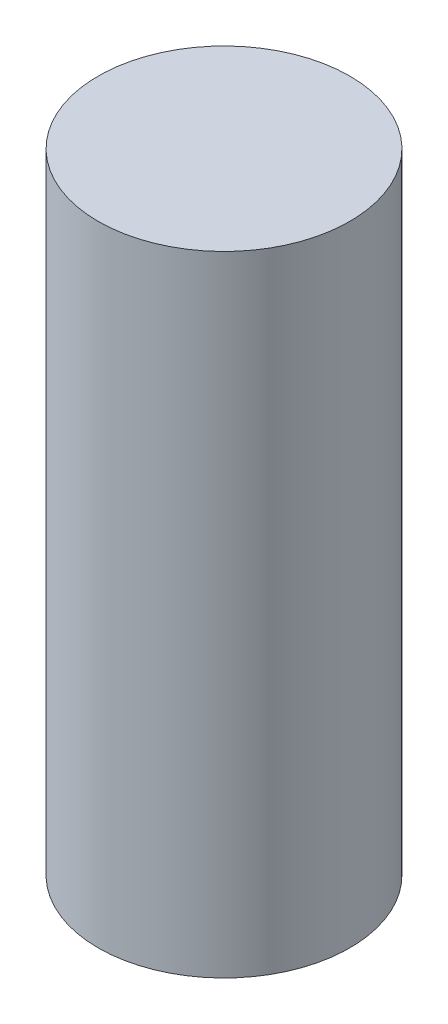
from build123d import *

# Parameters (mm, degrees)
SKETCH1_R             = 4
COUPLING_HIEGHT_DEPTH = 20


with BuildPart() as part:
    # Sketch1 → coupling hieght (new body)
    with BuildSketch(Plane(origin=(0, 0, 0), x_dir=(1, 0, 0), z_dir=(0, 1, 0))):
        with Locations(Location((0, 0, 0), (0, 0, 270))):
            Circle(SKETCH1_R)
    extrude(amount=COUPLING_HIEGHT_DEPTH)


solid = part.part
